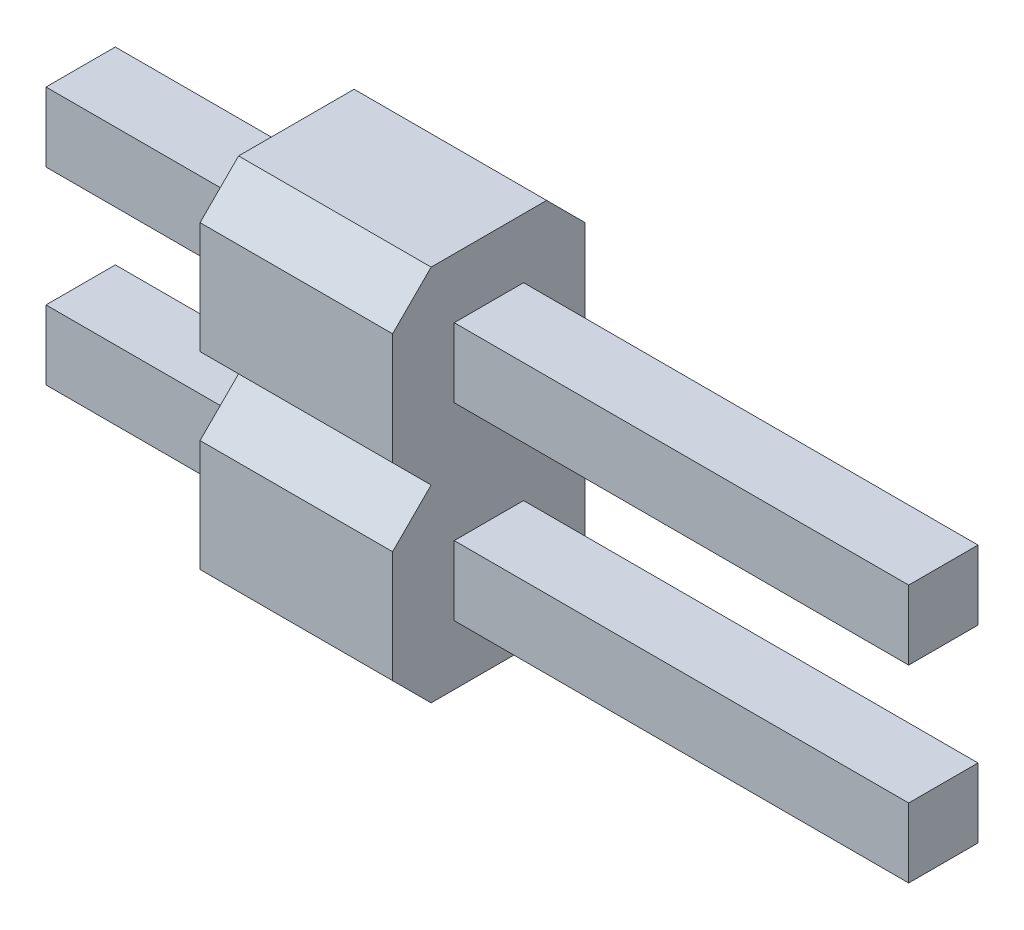
from build123d import *

# Parameters (mm, degrees)
SKICA1_W                 = 2.5
SKICA1_H                 = 4.9
P_IDAT_VYSUNUT_M1_DEPTH  = 2.5
ODEBRAT_VYSUNUT_M1_DEPTH = 2.5
SKICA4_W                 = 0.9
SKICA4_H                 = 0.9
P_IDAT_VYSUNUT_M2_DEPTH  = 5.9
SKICA5_W                 = 0.9
SKICA5_H                 = 0.9
P_IDAT_VYSUNUT_M3_DEPTH  = 2.8


with BuildPart() as part:
    # Skica1 → Přidat vysunutím1 (new body)
    with BuildSketch(Plane.XY):
        with Locations((-1.25, 2.45)):
            Rectangle(SKICA1_W, SKICA1_H)
    extrude(amount=P_IDAT_VYSUNUT_M1_DEPTH)

    # Skica3 → Odebrat vysunutím1 (cut)
    with BuildSketch(Plane(origin=(0, 0, 0), x_dir=(0, 0, -1), z_dir=(1, 0, 0))):
        Polygon((-2.5, 2.95), (-2, 2.45), (-2.5, 1.95), align=None)
        Polygon((0, 2.95), (-0.5, 2.45), (0, 1.95), align=None)
        Polygon((-2, 4.9), (-2.5, 4.4), (-2.5, 4.9), align=None)
        Polygon((-2.5, 0.5), (-2, 0), (-2.5, 0), align=None)
        Polygon((-0.5, 0), (0, 0.5), (0, 0), align=None)
        Polygon((0, 4.9), (0, 4.4), (-0.5, 4.9), align=None)
    extrude(amount=-ODEBRAT_VYSUNUT_M1_DEPTH, mode=Mode.SUBTRACT)

    # Skica4 → Přidat vysunutím2 (add)
    with BuildSketch(Plane(origin=(0, 0, 0), x_dir=(0, 0, -1), z_dir=(1, 0, 0))):
        with Locations((-1.25, 3.675)):
            Rectangle(SKICA4_W, SKICA4_H)
        with Locations((-1.25, 1.225)):
            Rectangle(SKICA4_W, SKICA4_H)
    extrude(amount=P_IDAT_VYSUNUT_M2_DEPTH)

    # Skica5 → Přidat vysunutím3 (add)
    with BuildSketch(Plane.ZY.offset(2.5)):
        with Locations((1.25, 3.675)):
            Rectangle(SKICA5_W, SKICA5_H)
        with Locations((1.25, 1.225)):
            Rectangle(SKICA5_W, SKICA5_H)
    extrude(amount=P_IDAT_VYSUNUT_M3_DEPTH)


solid = part.part
